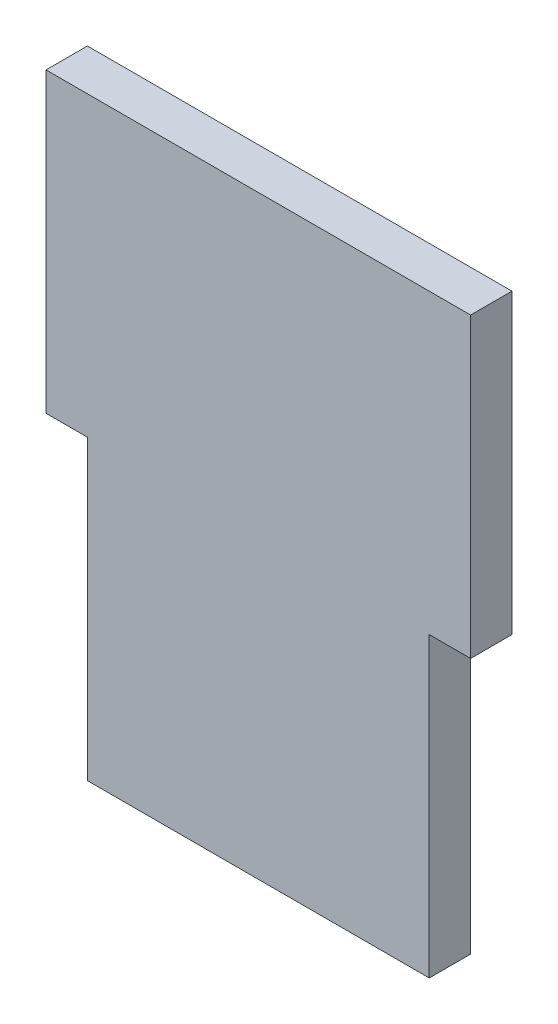
from build123d import *

# Parameters (mm, degrees)
BOSS_EXTRUDE1_DEPTH = 3.0734


with BuildPart() as part:
    # Sketch1 → Boss-Extrude1 (new body)
    with BuildSketch(Plane.XY):
        Polygon((28.4734, 44.196), (-3.0734, 44.196), (-3.0734, 22.098), (0, 22.098), (0, 0), (25.4, 0), (25.4, 22.098), (28.4734, 22.098), align=None)
    extrude(amount=BOSS_EXTRUDE1_DEPTH)


solid = part.part
